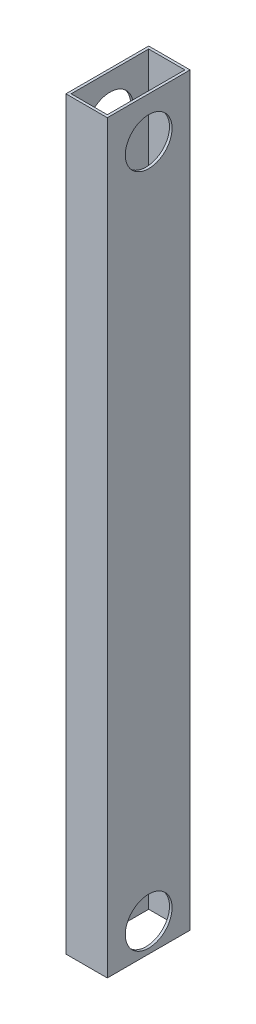
from build123d import *

# Parameters (mm, degrees)
SKETCH1_W           = 25.4
SKETCH1_H           = 50.8
SKETCH1_W_2         = 22.225
SKETCH1_H_2         = 47.625
EXTRUDE_THIN1_DEPTH = 457.2
SKETCH2_R           = 14.351
CUT_EXTRUDE1_DEPTH  = 461.714271539


with BuildPart() as part:
    # Sketch1 → Extrude-Thin1 (new body)
    with BuildSketch(Plane(origin=(0, 0, 0), x_dir=(1, 0, 0), z_dir=(0, 1, 0))):
        with Locations((12.7, 25.4)):
            Rectangle(SKETCH1_W, SKETCH1_H)
        with Locations((12.7, 25.4)):
            Rectangle(SKETCH1_W_2, SKETCH1_H_2, mode=Mode.SUBTRACT)
    extrude(amount=EXTRUDE_THIN1_DEPTH)

    # Sketch2 → Cut-Extrude1 (cut, through all)
    with BuildSketch(Plane(origin=(25.4, 0, 0), x_dir=(0, 0, -1), z_dir=(1, 0, 0))):
        with Locations((25.4, 17.526)):
            Circle(SKETCH2_R)
        with Locations((25.4, 431.8)):
            Circle(SKETCH2_R)
    extrude(amount=-CUT_EXTRUDE1_DEPTH, mode=Mode.SUBTRACT)


solid = part.part
